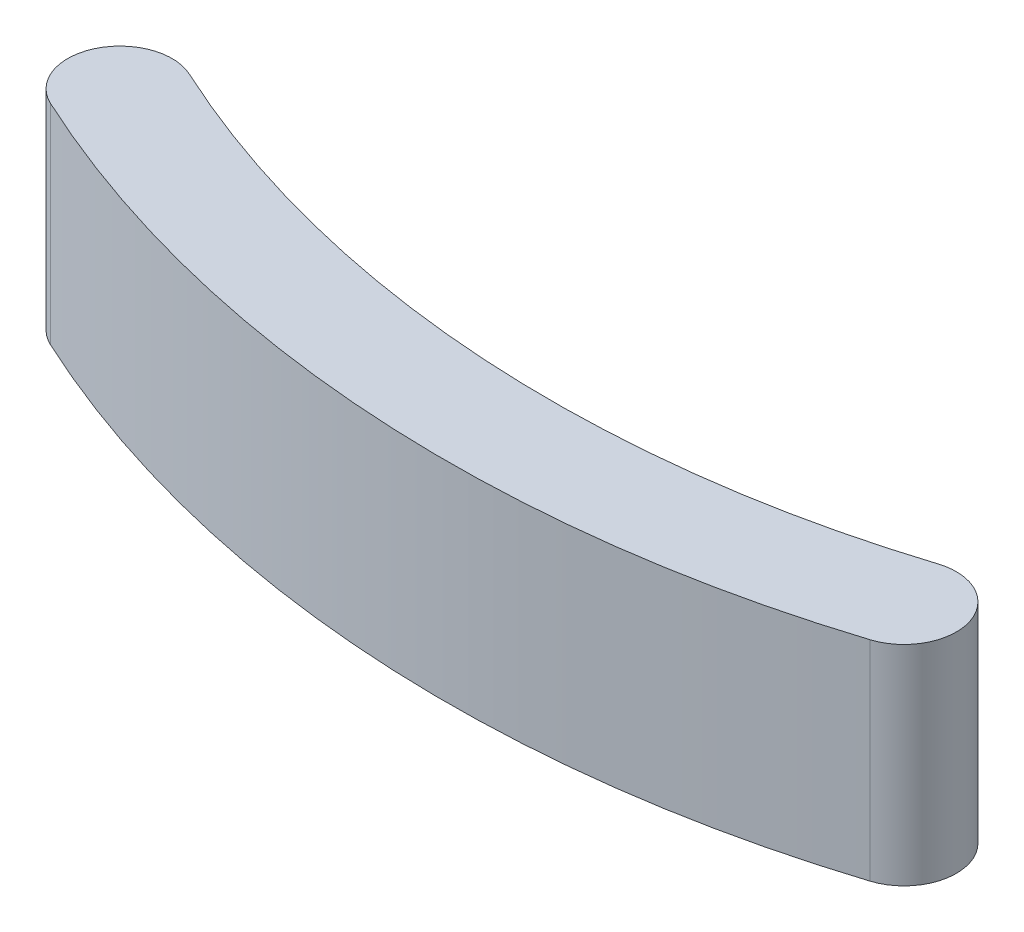
from build123d import *

# Parameters (mm, degrees)
BOSS_EXTRUDE1_DEPTH = 20


with BuildPart() as part:
    # Sketch1 → Boss-Extrude1 (new body)
    with BuildSketch(Plane(origin=(0, 0, 0), x_dir=(1, 0, 0), z_dir=(0, 1, 0))):
        with BuildLine():
            ThreePointArc((-2.098499702, -4.538314555), (39.219358569, -14.990262892), (81.517086997, -9.764288724))
            ThreePointArc((81.517086997, -9.764288724), (84.764288724, -3.482913003), (78.482913003, -0.235711276))
            ThreePointArc((78.482913003, -0.235711276), (39.843141431, -5.009737108), (2.098499702, 4.538314555))
            ThreePointArc((2.098499702, 4.538314555), (-4.538314555, 2.098499702), (-2.098499702, -4.538314555))
        make_face()
    extrude(amount=BOSS_EXTRUDE1_DEPTH)


solid = part.part
